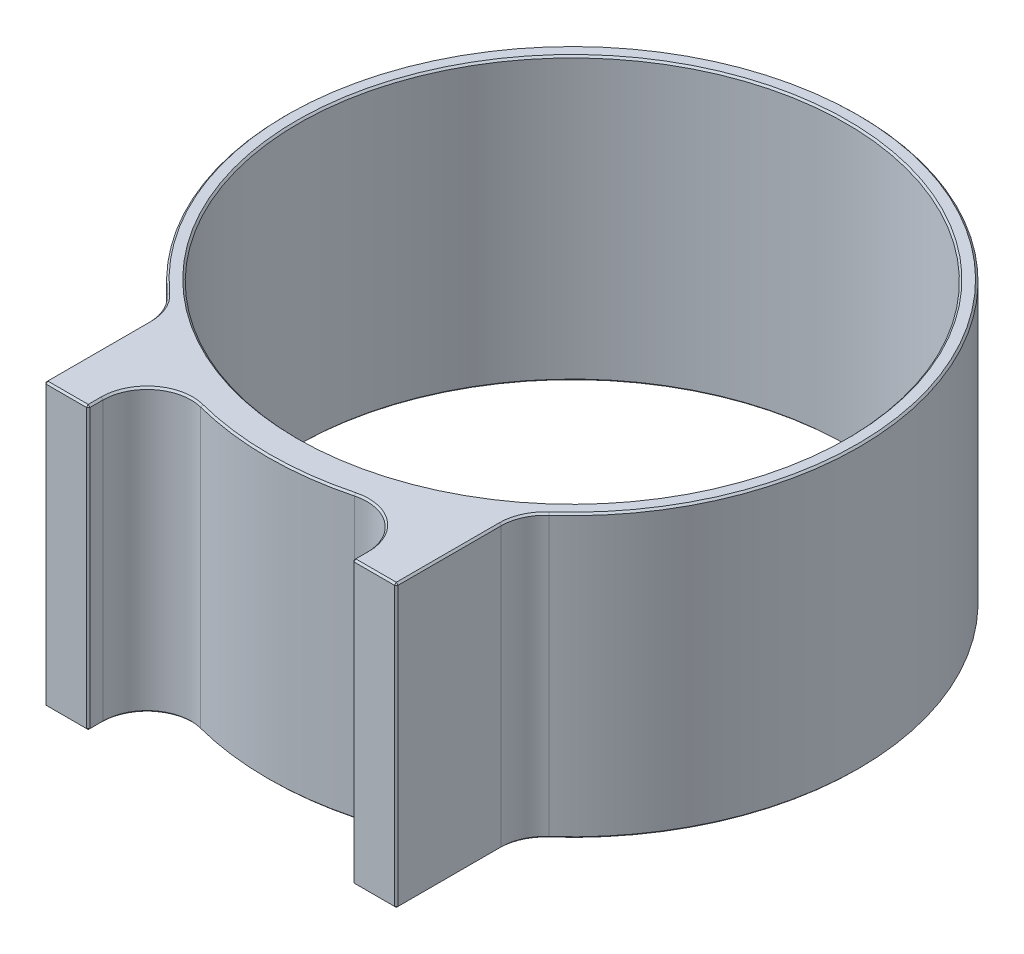
from build123d import *

# Parameters (mm, degrees)
SKETCH_1_R          = 62.2
EXTRUDE_2_DEPTH     = 64
CUT_EXTRUDE_1_DEPTH = 122.437391276
FILLET_1_R          = 10
CHAMFER_1_SIZE      = 0.4


with BuildPart() as part:
    # 草图1 → 凸台-拉伸2 (new body)
    with BuildSketch(Plane(origin=(0, 0, 0), x_dir=(1, 0, 0), z_dir=(0, 1, 0))):
        with BuildLine():
            Line((-40, -51.488251087), (-40, -80))
            Line((-40, -80), (40, -80))
            Line((40, -80), (40, -51.488251087))
            ThreePointArc((40, -51.488251087), (0, 65.2), (-40, -51.488251087))
        make_face()
        with Locations(Location((0, 0, 0), (0, 0, 270))):
            Circle(SKETCH_1_R, mode=Mode.SUBTRACT)
    extrude(amount=EXTRUDE_2_DEPTH)

    # 草图2 → 切除-拉伸1 (cut, through all)
    with BuildSketch(Plane(origin=(0, 64, 0), x_dir=(1, 0, 0), z_dir=(0, 1, 0))):
        with BuildLine():
            Line((-30, -80), (30, -80))
            Line((30, -80), (30, -62.376598176))
            ThreePointArc((30, -62.376598176), (0, -69.215894128), (-30, -62.376598176))
            Line((-30, -62.376598176), (-30, -80))
        make_face()
    extrude(amount=-CUT_EXTRUDE_1_DEPTH, mode=Mode.SUBTRACT)

    # 圆角1
    fillet_1_edges = [part.edges().sort_by_distance(p)[0] for p in [
        (-30, 32, 62.376598176),
        (30, 32, 62.376598176),
        (-40, 32, 51.488251087),
        (40, 32, 51.488251087),
    ]]
    fillet(fillet_1_edges, radius=FILLET_1_R)

    # 倒角1
    chamfer_1_edges = [part.edges().sort_by_distance(p)[0] for p in [
        (0, 0, -62.2),
        (0, 64, -62.2),
        (-35, 64, 80),
        (35, 0, 80),
        (35, 64, 80),
        (-30, 32, 80),
        (30, 0, 78.324789245),
        (30, 32, 80),
        (30, 64, 78.324789245),
        (-30, 64, 78.324789245),
        (-30, 0, 78.324789245),
        (0, 64, 69.215894128),
        (0, 0, 69.215894128),
        (0, 0, -65.2),
        (0, 64, -65.2),
        (-40, 0, 68.084871372),
        (-40, 64, 68.084871372),
        (-26.113613559, 64, 68.736062883),
        (-26.113613559, 0, 68.736062883),
        (26.113613559, 64, 68.736062883),
        (26.113613559, 0, 68.736062883),
        (40.876147697, 0, 52.076416573),
        (40.876147697, 64, 52.076416573),
        (-40.876147697, 0, 52.076416573),
        (-40.876147697, 64, 52.076416573),
        (40, 64, 68.084871372),
        (-35, 0, 80),
        (40, 0, 68.084871372),
        (40, 32, 80),
        (-40, 32, 80),
    ]]
    chamfer(chamfer_1_edges, length=CHAMFER_1_SIZE)


solid = part.part
